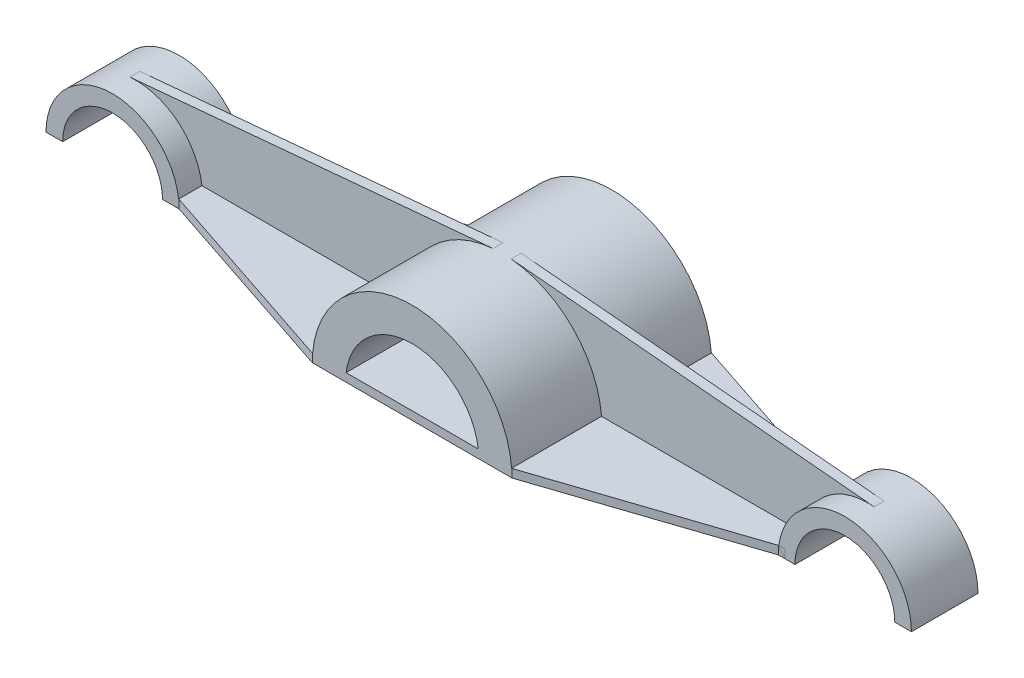
from build123d import *

# Parameters (mm, degrees)
BOSS_EXTRUDE1_DEPTH = 30
BOSS_EXTRUDE2_DEPTH = 10
BOSS_EXTRUDE3_DEPTH = 10
BOSS_EXTRUDE4_DEPTH = 2.5
BOSS_EXTRUDE5_START = 3
BOSS_EXTRUDE5_DEPTH = 3


with BuildPart() as part:
    # Sketch1 → Boss-Extrude1 (new, symmetric)
    with BuildSketch(Plane.XY):
        with BuildLine():
            Line((20, 0), (30, 0))
            ThreePointArc((30, 0), (0, 30), (-30, 0))
            Line((-30, 0), (-20, 0))
            ThreePointArc((-20, 0), (0, 20), (20, 0))
        make_face()
    extrude(amount=BOSS_EXTRUDE1_DEPTH, both=True)

    # Sketch4 → Boss-Extrude4 (add)
    with BuildSketch(Plane(origin=(0, 0, 0), x_dir=(1, 0, 0), z_dir=(0, 1, 0))):
        Polygon((-90, 10), (-30, 30), (30, 30), (90, 10), (92, 10), (92, -10), (90, -10), (30, -30), (-30, -30), (-90, -10), (-92, -10), (-92, 10), align=None)
    extrude(amount=BOSS_EXTRUDE4_DEPTH)



with BuildPart() as body_2:
    # Sketch1<3> → Boss-Extrude2 (new, symmetric)
    with BuildSketch(Plane.XY):
        with BuildLine():
            Line((-130, 0), (-125, 0))
            ThreePointArc((-125, 0), (-110, 15), (-95, 0))
            Line((-95, 0), (-90, 0))
            ThreePointArc((-90, 0), (-110, 20), (-130, 0))
        make_face()
    extrude(amount=BOSS_EXTRUDE2_DEPTH, both=True)


with BuildPart() as body_3:
    # Sketch1<4> → Boss-Extrude3 (new, symmetric)
    with BuildSketch(Plane.XY):
        with BuildLine():
            Line((90, 0), (95, 0))
            ThreePointArc((95, 0), (110, 15), (125, 0))
            Line((125, 0), (130, 0))
            ThreePointArc((130, 0), (110, 20), (90, 0))
        make_face()
    extrude(amount=BOSS_EXTRUDE3_DEPTH, both=True)


with BuildPart() as part_1:
    add(part.part)

    add(body_2.part)  # Boss-Extrude5 merges body 2
    # Sketch7 → Boss-Extrude5 (add)
    with BuildSketch(Plane.XY.offset(BOSS_EXTRUDE5_START)):
        with BuildLine():
            Line((-111.818181818, 19.917183909), (-2.727272727, 29.875775864))
            ThreePointArc((-2.727272727, 29.875775864), (-22.156468376, 20.225995874), (-30, 0))
            Line((-30, 0), (-90, 0))
            ThreePointArc((-90, 0), (-96.516002751, 14.770978918), (-111.818181818, 19.917183909))
        make_face()
    boss_extrude5 = extrude(amount=-BOSS_EXTRUDE5_DEPTH)

    # Mirror1: Boss-Extrude5 across plane
    add(boss_extrude5.mirror(Plane(origin=(0, 0, 0), x_dir=(0, 0, 1), z_dir=(1, 0, 0))))


solid = Compound([body_3.part, part_1.part])
